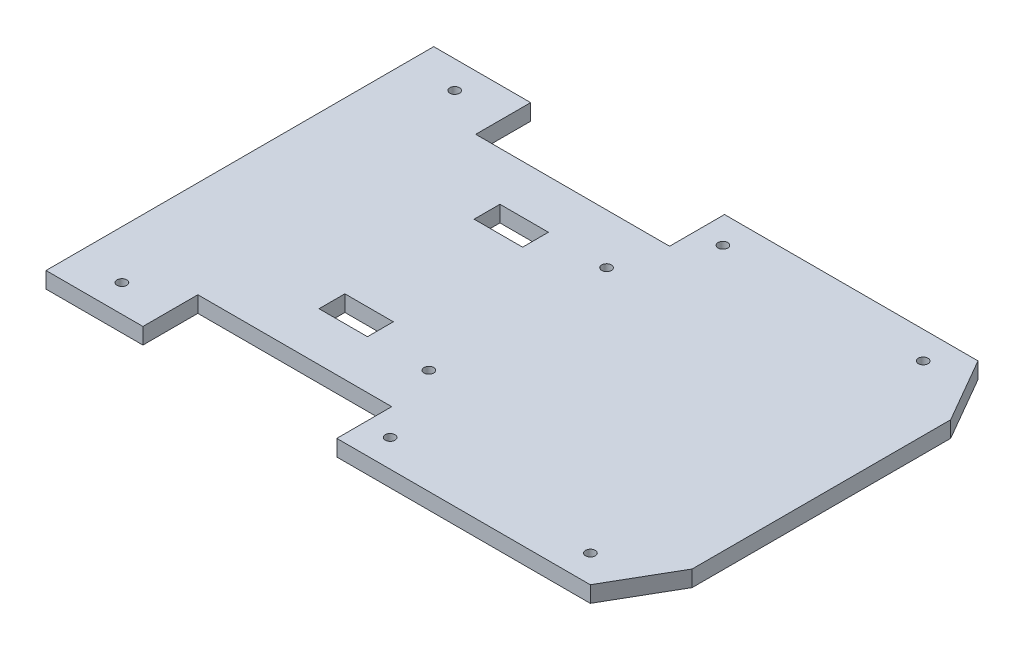
from build123d import *

# Parameters (mm, degrees)
ESQUISSE1_R        = 1.5
ESQUISSE1_W        = 15
ESQUISSE1_H        = 8
BOSS_EXTRU_1_DEPTH = 5


with BuildPart() as part:
    # Esquisse1 → Boss.-Extru.1 (new body)
    with BuildSketch(Plane(origin=(0, 0, 0), x_dir=(1, 0, 0), z_dir=(0, 1, 0))):
        Polygon((78.452994616, 60), (90, 40), (90, 0), (-90, 0), (-90, 60), (-60, 60), (-60, 43), (0, 43), (0, 60), align=None)
        with Locations(Location((-75, 51.5, 0), (0, 0, 270))):
            Circle(ESQUISSE1_R, mode=Mode.SUBTRACT)
        with Locations(Location((8, 51.5, 0), (0, 0, 270))):
            Circle(ESQUISSE1_R, mode=Mode.SUBTRACT)
        with Locations(Location((70, 51.5, 0), (0, 0, 270))):
            Circle(ESQUISSE1_R, mode=Mode.SUBTRACT)
        with Locations(Location((-4, 27.5, 0), (0, 0, 270))):
            Circle(ESQUISSE1_R, mode=Mode.SUBTRACT)
        with Locations((-30, 24)):
            Rectangle(ESQUISSE1_W, ESQUISSE1_H, mode=Mode.SUBTRACT)
    boss_extru_1 = extrude(amount=BOSS_EXTRU_1_DEPTH)

    # Symétrie1: Boss.-Extru.1 across plane
    add(boss_extru_1.mirror(Plane(origin=(-90, 5, 0), x_dir=(1, 0, 0), z_dir=(0, 0, -1))))


solid = part.part
